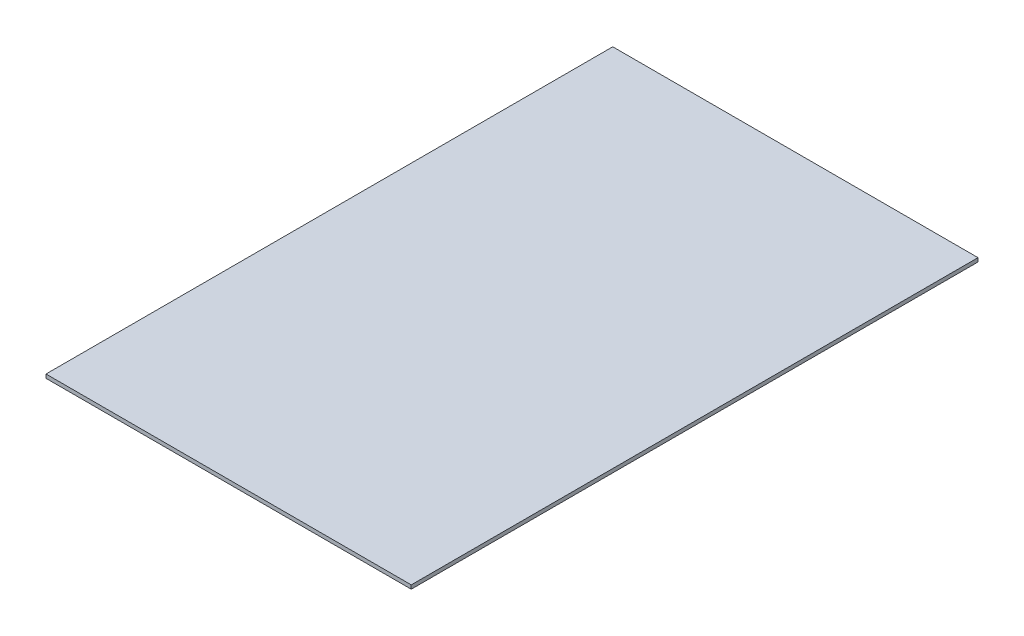
from build123d import *

# Parameters (mm, degrees)
SKETCH1_W           = 580
SKETCH1_H           = 900
BOSS_EXTRUDE1_DEPTH = 6


with BuildPart() as part:
    # Sketch1 → Boss-Extrude1 (new body)
    with BuildSketch(Plane(origin=(0, 0, 0), x_dir=(1, 0, 0), z_dir=(0, 1, 0))):
        with Locations((290, 450)):
            Rectangle(SKETCH1_W, SKETCH1_H)
    extrude(amount=BOSS_EXTRUDE1_DEPTH)


solid = part.part
